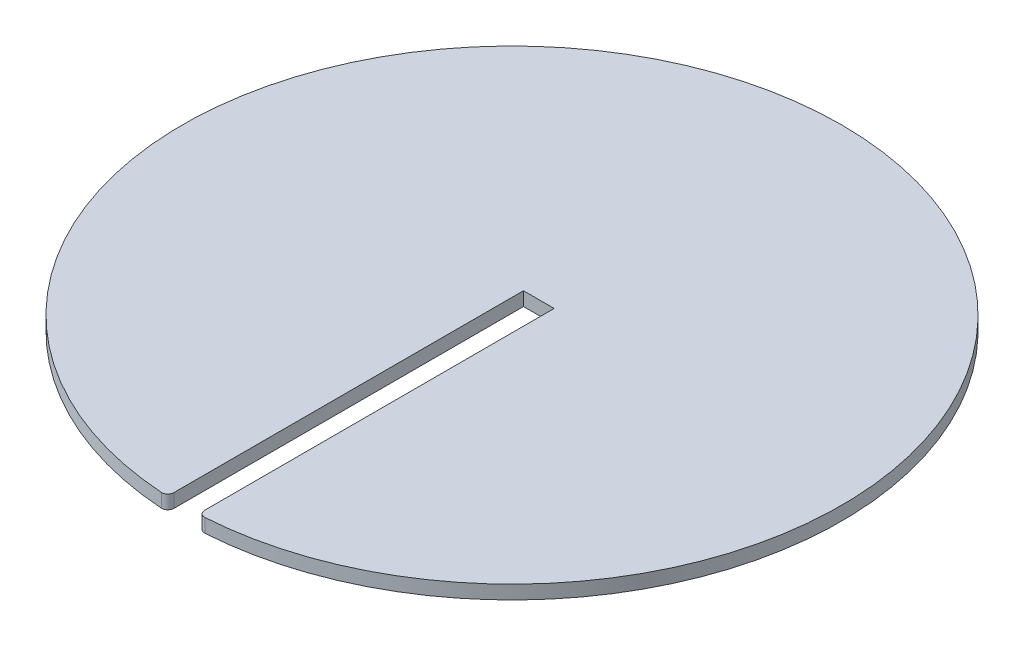
from build123d import *

# Parameters (mm, degrees)
BOSS_EXTRUDE1_DEPTH = 1.5875
FILLET1_R           = 0.7


with BuildPart() as part:
    # Sketch1 → Boss-Extrude1 (new body)
    with BuildSketch(Plane(origin=(0, 0, 0), x_dir=(1, 0, 0), z_dir=(0, 1, 0))):
        with BuildLine():
            Line((2.408495171, 1.948589223), (2.408495171, -33.010041533))
            ThreePointArc((2.408495171, -33.010041533), (4.183495171, 43.148589223), (5.958495171, -33.010041533))
            Line((5.958495171, -33.010041533), (5.958495171, 1.948589223))
            Line((5.958495171, 1.948589223), (5.958495171, 8.148589223))
            Line((5.958495171, 8.148589223), (2.408495171, 8.148589223))
            Line((2.408495171, 8.148589223), (2.408495171, 1.948589223))
        make_face()
    extrude(amount=BOSS_EXTRUDE1_DEPTH)

    # Fillet1
    fillet1_edges = [part.edges().sort_by_distance(p)[0] for p in [
        (2.408495171, 0.79375, 33.010041533),
        (5.958495171, 0.79375, 33.010041533),
    ]]
    fillet(fillet1_edges, radius=FILLET1_R)


solid = part.part
